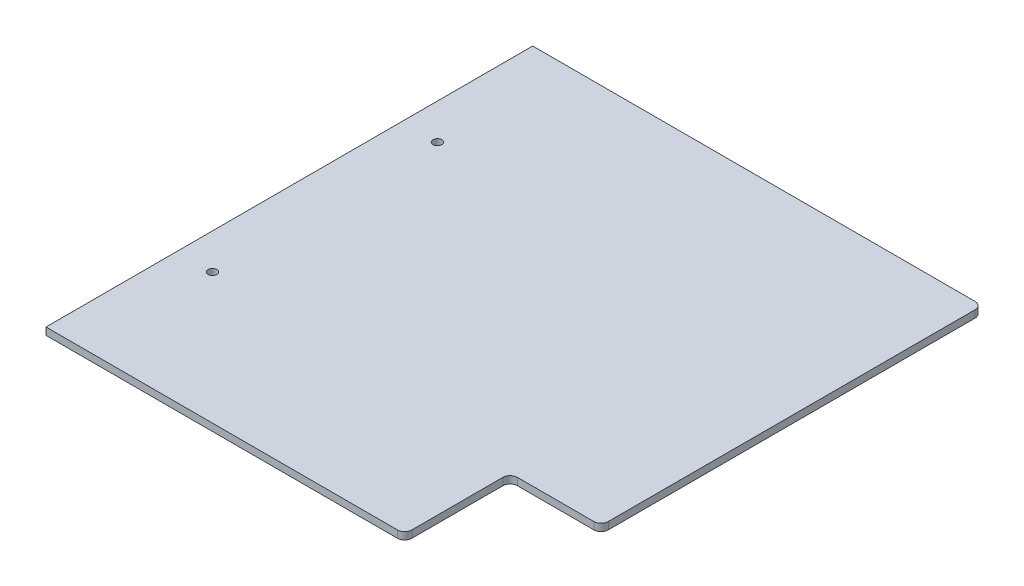
from build123d import *

# Parameters (mm, degrees)
CROQUIS1_R              = 3
SALIENTE_EXTRUIR1_DEPTH = 5
REDONDEO1_R             = 5


with BuildPart() as part:
    # Croquis1 → Saliente-Extruir1 (new body)
    with BuildSketch(Plane(origin=(0, 0, 0), x_dir=(1, 0, 0), z_dir=(0, 1, 0))):
        Polygon((-117.776848249, -199.571984436), (-117.776848249, 134.928015564), (191.223151751, 134.928015564), (191.223151751, -127.071984436), (128.723151751, -127.071984436), (128.723151751, -199.571984436), align=None)
        with Locations(Location((-93.276848249, 44.928015564, 0), (0, 0, 270))):
            Circle(CROQUIS1_R, mode=Mode.SUBTRACT)
        with Locations(Location((-93.276848249, -109.571984436, 0), (0, 0, 270))):
            Circle(CROQUIS1_R, mode=Mode.SUBTRACT)
    extrude(amount=SALIENTE_EXTRUIR1_DEPTH)

    # Redondeo1
    redondeo1_edges = [part.edges().sort_by_distance(p)[0] for p in [
        (191.223151751, 2.5, 127.071984436),
        (128.723151751, 2.5, 127.071984436),
        (128.723151751, 2.5, 199.571984436),
        (191.223151751, 2.5, -134.928015564),
    ]]
    fillet(redondeo1_edges, radius=REDONDEO1_R)


solid = part.part
